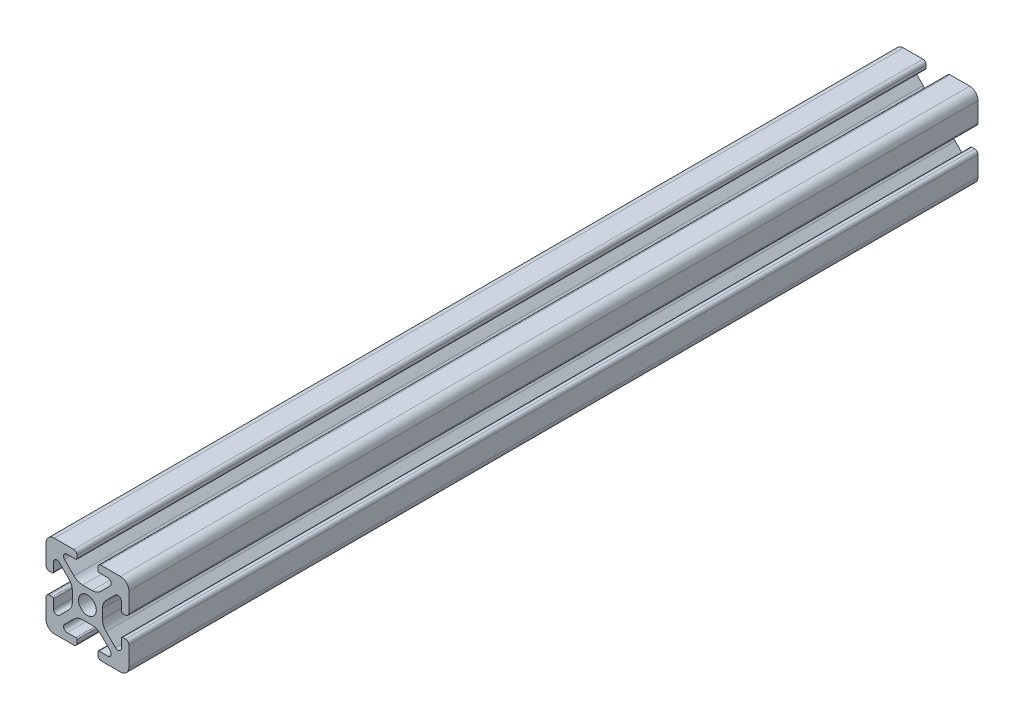
from build123d import *

# Parameters (mm, degrees)
SKETCH1_R           = 2.1463
BOSS_EXTRUDE1_DEPTH = 102.5


with BuildPart() as part:
    # Sketch1 → Boss-Extrude1 (new, symmetric)
    with BuildSketch(Plane.XY):
        with BuildLine():
            Line((-9.9949, 7.9883), (-9.9949, 3.2893))
            ThreePointArc((-9.9949, 3.2893), (-9.76427588, 2.73252412), (-9.2075, 2.5019))
            Line((-9.2075, 2.5019), (-8.4963, 2.5019))
            ThreePointArc((-8.4963, 2.5019), (-8.280773853, 2.591173853), (-8.1915, 2.8067))
            Line((-8.1915, 2.8067), (-8.1915, 4.9149))
            ThreePointArc((-8.1915, 4.9149), (-7.674065253, 5.689295824), (-6.760603096, 5.507596904))
            Line((-6.760603096, 5.507596904), (-4.505765747, 3.252759555))
            ThreePointArc((-4.505765747, 3.252759555), (-3.856054457, 2.280397894), (-3.627906192, 1.133419111))
            Line((-3.627906192, 1.133419111), (-3.627906192, -1.133419111))
            ThreePointArc((-3.627906192, -1.133419111), (-3.856054457, -2.280397894), (-4.505765747, -3.252759555))
            Line((-4.505765747, -3.252759555), (-6.760603096, -5.507596904))
            ThreePointArc((-6.760603096, -5.507596904), (-7.674065253, -5.689295824), (-8.1915, -4.9149))
            Line((-8.1915, -4.9149), (-8.1915, -2.8067))
            ThreePointArc((-8.1915, -2.8067), (-8.280773853, -2.591173853), (-8.4963, -2.5019))
            Line((-8.4963, -2.5019), (-9.2075, -2.5019))
            ThreePointArc((-9.2075, -2.5019), (-9.76427588, -2.73252412), (-9.9949, -3.2893))
            Line((-9.9949, -3.2893), (-9.9949, -7.9883))
            ThreePointArc((-9.9949, -7.9883), (-9.407180467, -9.407180467), (-7.9883, -9.9949))
            Line((-7.9883, -9.9949), (-3.2893, -9.9949))
            ThreePointArc((-3.2893, -9.9949), (-2.73252412, -9.76427588), (-2.5019, -9.2075))
            Line((-2.5019, -9.2075), (-2.5019, -8.4963))
            ThreePointArc((-2.5019, -8.4963), (-2.591173853, -8.280773853), (-2.8067, -8.1915))
            Line((-2.8067, -8.1915), (-4.9149, -8.1915))
            ThreePointArc((-4.9149, -8.1915), (-5.689295824, -7.674065253), (-5.507596904, -6.760603096))
            Line((-5.507596904, -6.760603096), (-3.252759555, -4.505765747))
            ThreePointArc((-3.252759555, -4.505765747), (-2.280397894, -3.856054457), (-1.133419111, -3.627906192))
            Line((-1.133419111, -3.627906192), (1.133419111, -3.627906192))
            ThreePointArc((1.133419111, -3.627906192), (2.280397894, -3.856054457), (3.252759555, -4.505765747))
            Line((3.252759555, -4.505765747), (5.507596904, -6.760603096))
            ThreePointArc((5.507596904, -6.760603096), (5.689295824, -7.674065253), (4.9149, -8.1915))
            Line((4.9149, -8.1915), (2.8067, -8.1915))
            ThreePointArc((2.8067, -8.1915), (2.591173853, -8.280773853), (2.5019, -8.4963))
            Line((2.5019, -8.4963), (2.5019, -9.2075))
            ThreePointArc((2.5019, -9.2075), (2.73252412, -9.76427588), (3.2893, -9.9949))
            Line((3.2893, -9.9949), (7.9883, -9.9949))
            ThreePointArc((7.9883, -9.9949), (9.407180467, -9.407180467), (9.9949, -7.9883))
            Line((9.9949, -7.9883), (9.9949, -3.2893))
            ThreePointArc((9.9949, -3.2893), (9.76427588, -2.73252412), (9.2075, -2.5019))
            Line((9.2075, -2.5019), (8.4963, -2.5019))
            ThreePointArc((8.4963, -2.5019), (8.280773853, -2.591173853), (8.1915, -2.8067))
            Line((8.1915, -2.8067), (8.1915, -4.9149))
            ThreePointArc((8.1915, -4.9149), (7.674065253, -5.689295824), (6.760603096, -5.507596904))
            Line((6.760603096, -5.507596904), (4.505765747, -3.252759555))
            ThreePointArc((4.505765747, -3.252759555), (3.856054457, -2.280397894), (3.627906192, -1.133419111))
            Line((3.627906192, -1.133419111), (3.627906192, 1.133419111))
            ThreePointArc((3.627906192, 1.133419111), (3.856054457, 2.280397894), (4.505765747, 3.252759555))
            Line((4.505765747, 3.252759555), (6.760603096, 5.507596904))
            ThreePointArc((6.760603096, 5.507596904), (7.674065253, 5.689295824), (8.1915, 4.9149))
            Line((8.1915, 4.9149), (8.1915, 2.8067))
            ThreePointArc((8.1915, 2.8067), (8.280773853, 2.591173853), (8.4963, 2.5019))
            Line((8.4963, 2.5019), (9.2075, 2.5019))
            ThreePointArc((9.2075, 2.5019), (9.76427588, 2.73252412), (9.9949, 3.2893))
            Line((9.9949, 3.2893), (9.9949, 7.9883))
            ThreePointArc((9.9949, 7.9883), (9.407180467, 9.407180467), (7.9883, 9.9949))
            Line((7.9883, 9.9949), (3.2893, 9.9949))
            ThreePointArc((3.2893, 9.9949), (2.73252412, 9.76427588), (2.5019, 9.2075))
            Line((2.5019, 9.2075), (2.5019, 8.4963))
            ThreePointArc((2.5019, 8.4963), (2.591173853, 8.280773853), (2.8067, 8.1915))
            Line((2.8067, 8.1915), (4.9149, 8.1915))
            ThreePointArc((4.9149, 8.1915), (5.689295824, 7.674065253), (5.507596904, 6.760603096))
            Line((5.507596904, 6.760603096), (3.252759555, 4.505765747))
            ThreePointArc((3.252759555, 4.505765747), (2.280397894, 3.856054457), (1.133419111, 3.627906192))
            Line((1.133419111, 3.627906192), (-1.133419111, 3.627906192))
            ThreePointArc((-1.133419111, 3.627906192), (-2.280397894, 3.856054457), (-3.252759555, 4.505765747))
            Line((-3.252759555, 4.505765747), (-5.507596904, 6.760603096))
            ThreePointArc((-5.507596904, 6.760603096), (-5.689295824, 7.674065253), (-4.9149, 8.1915))
            Line((-4.9149, 8.1915), (-2.8067, 8.1915))
            ThreePointArc((-2.8067, 8.1915), (-2.591173853, 8.280773853), (-2.5019, 8.4963))
            Line((-2.5019, 8.4963), (-2.5019, 9.2075))
            ThreePointArc((-2.5019, 9.2075), (-2.73252412, 9.76427588), (-3.2893, 9.9949))
            Line((-3.2893, 9.9949), (-7.9883, 9.9949))
            ThreePointArc((-7.9883, 9.9949), (-9.407180467, 9.407180467), (-9.9949, 7.9883))
        make_face()
        with Locations(Location((0, 0, 0), (0, 0, 180))):
            Circle(SKETCH1_R, mode=Mode.SUBTRACT)
    extrude(amount=BOSS_EXTRUDE1_DEPTH, both=True)


solid = part.part
